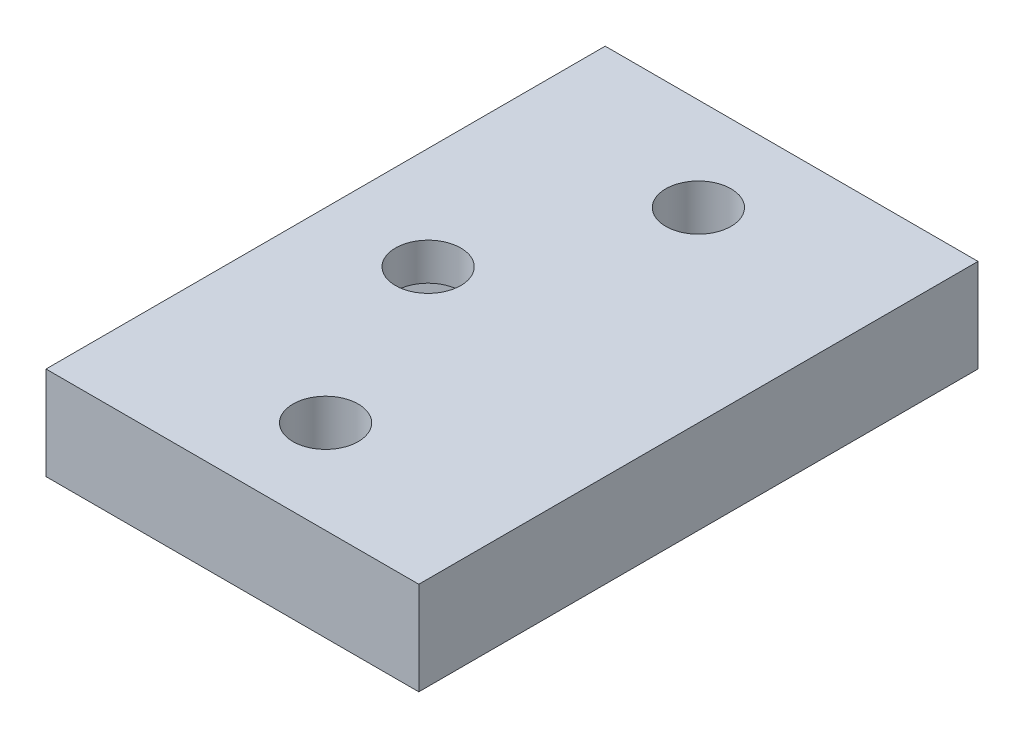
from build123d import *

# Parameters (mm, degrees)
SKETCH1_W           = 20
SKETCH1_H           = 30
BOSS_EXTRUDE1_DEPTH = 5
SKETCH2_R           = 1.75
CUT_EXTRUDE1_DEPTH  = 8
SKETCH3_R           = 1.75
CUT_EXTRUDE2_DEPTH  = 37.400549446
SKETCH4_W           = 6
SKETCH4_H           = 3
CUT_EXTRUDE3_DEPTH  = 9


with BuildPart() as part:
    # Sketch1 → Boss-Extrude1 (new body)
    with BuildSketch(Plane(origin=(0, 0, 0), x_dir=(1, 0, 0), z_dir=(0, 1, 0))):
        with Locations((10, 15)):
            Rectangle(SKETCH1_W, SKETCH1_H)
    extrude(amount=BOSS_EXTRUDE1_DEPTH)

    # Sketch2 → Cut-Extrude1 (cut)
    with BuildSketch(Plane(origin=(0, 5, 0), x_dir=(1, 0, 0), z_dir=(0, 1, 0))):
        with Locations(Location((5.5, 15, 0), (0, 0, 270))):
            Circle(SKETCH2_R)
    extrude(amount=-CUT_EXTRUDE1_DEPTH, mode=Mode.SUBTRACT)

    # Sketch3 → Cut-Extrude2 (cut, through all)
    with BuildSketch(Plane(origin=(0, 5, 0), x_dir=(1, 0, 0), z_dir=(0, 1, 0))):
        with Locations(Location((10, 25, 0), (0, 0, 270))):
            Circle(SKETCH3_R)
        with Locations(Location((10, 5, 0), (0, 0, 270))):
            Circle(SKETCH3_R)
    extrude(amount=-CUT_EXTRUDE2_DEPTH, mode=Mode.SUBTRACT)

    # Sketch4 → Cut-Extrude3 (cut)
    with BuildSketch(Plane.ZY):
        with Locations((-15, 1.5)):
            Rectangle(SKETCH4_W, SKETCH4_H)
    extrude(amount=-CUT_EXTRUDE3_DEPTH, mode=Mode.SUBTRACT)


solid = part.part
